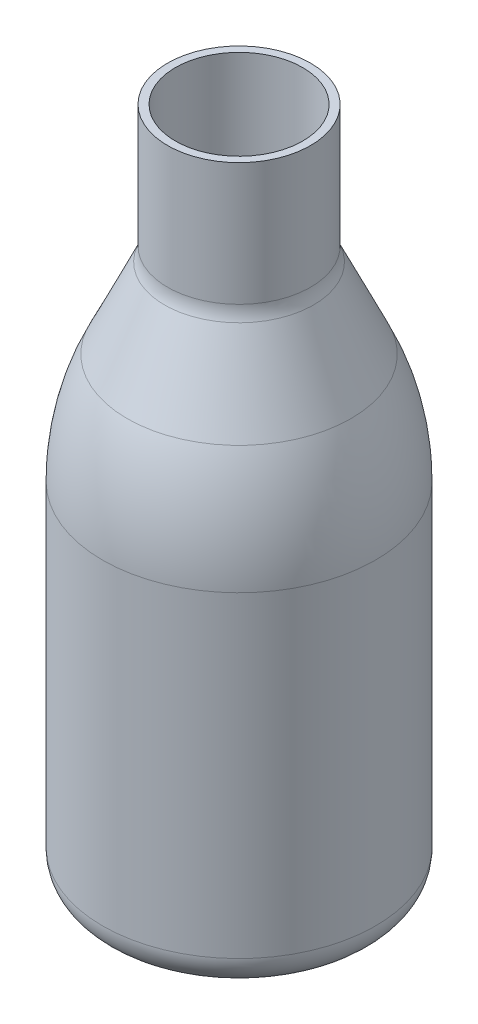
from build123d import *

# Parameters (mm, degrees)
FILLET1_R = 6.35
FILLET2_R = 50.8
SHELL1_T  = -1.524


with BuildPart() as part:
    # Sketch1 → Revolve1 (revolve)
    with BuildSketch(Plane.XY, mode=Mode.PRIVATE) as revolve1_sk:
        Polygon((0, 0), (0, 132.08), (-13.97, 132.08), (-13.97, 106.68), (-26.67, 79.574510135), (-26.67, 0), align=None)
    revolve(revolve1_sk.sketch.rotate(Axis((0, 0, 0), (0, 1, 0)), 270), axis=Axis((0, 0, 0), (0, 1, 0)))

    # Fillet1
    fillet1_edges = [part.edges().sort_by_distance(p)[0] for p in [
        (0, 106.68, 13.97),
        (0, 0, 26.67),
    ]]
    fillet(fillet1_edges, radius=FILLET1_R)

    # Fillet2
    fillet2_edges = [part.edges().sort_by_distance(p)[0] for p in [
        (0, 79.574510135, 26.67),
    ]]
    fillet(fillet2_edges, radius=FILLET2_R)

    # Shell1
    shell1_openings = [part.faces().sort_by_distance(p)[0] for p in [
        (0, 132.08, 0),
    ]]
    offset(amount=SHELL1_T, openings=shell1_openings, kind=Kind.INTERSECTION)


solid = part.part
